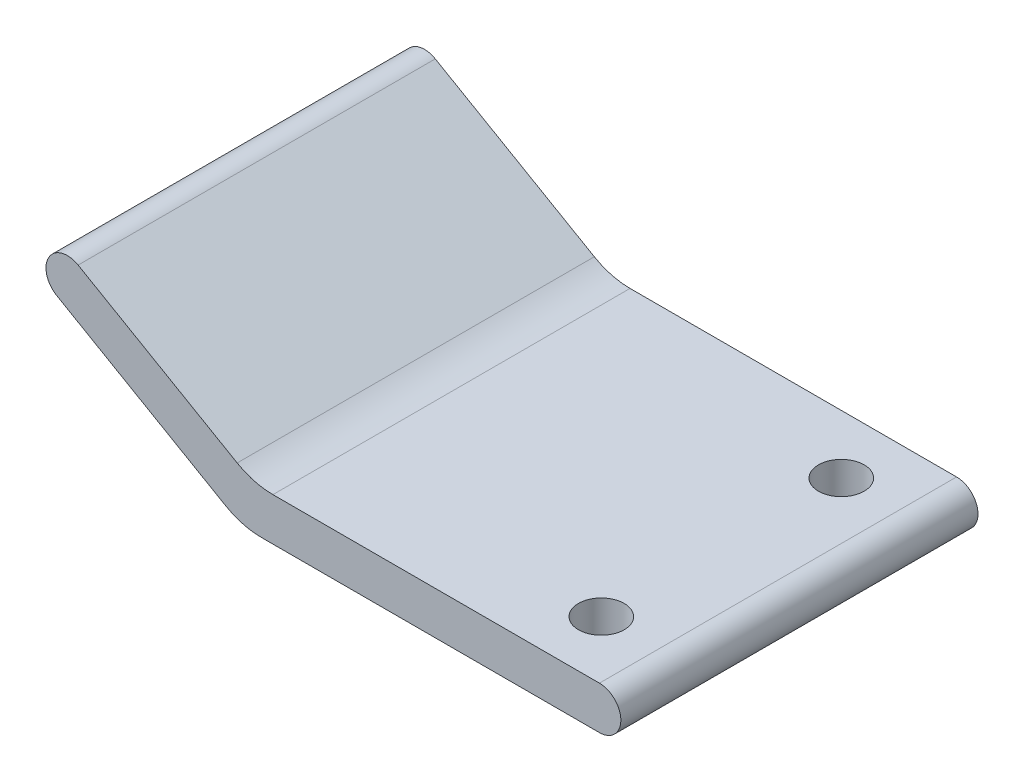
from build123d import *

# Parameters (mm, degrees)
BOSS_EXTRUDE1_DEPTH = 12.5
SKETCH2_R           = 1.6
CUT_EXTRUDE1_DEPTH  = 42.356294342
FILLET1_R           = 5


with BuildPart() as part:
    # Sketch1 → Boss-Extrude1 (new, symmetric)
    with BuildSketch(Plane.XY):
        with BuildLine():
            Line((0, 0), (-25, 0))
            Line((-25, 0), (-37.990381057, 7.5))
            ThreePointArc((-37.990381057, 7.5), (-38.539419162, 9.549038106), (-36.490381057, 10.098076211))
            Line((-36.490381057, 10.098076211), (-24.196152423, 3))
            Line((-24.196152423, 3), (0, 3))
            ThreePointArc((0, 3), (1.5, 1.5), (0, 0))
        make_face()
    extrude(amount=BOSS_EXTRUDE1_DEPTH, both=True)

    # Sketch2 → Cut-Extrude1 (cut, symmetric)
    with BuildSketch(Plane(origin=(0, 3, 0), x_dir=(1, 0, 0), z_dir=(0, 1, 0))):
        with Locations(Location((-3.968168997, -8.4, 0), (0, 0, 270))):
            Circle(SKETCH2_R)
    cut_extrude1 = extrude(amount=CUT_EXTRUDE1_DEPTH, both=True, mode=Mode.SUBTRACT)

    # Mirror1: Cut-Extrude1 across plane
    add(cut_extrude1.mirror(Plane.XY), mode=Mode.SUBTRACT)

    # Fillet1
    fillet1_edges = [part.edges().sort_by_distance(p)[0] for p in [
        (-25, 0, 0),
        (-24.196152423, 3, 0),
    ]]
    fillet(fillet1_edges, radius=FILLET1_R)


solid = part.part
